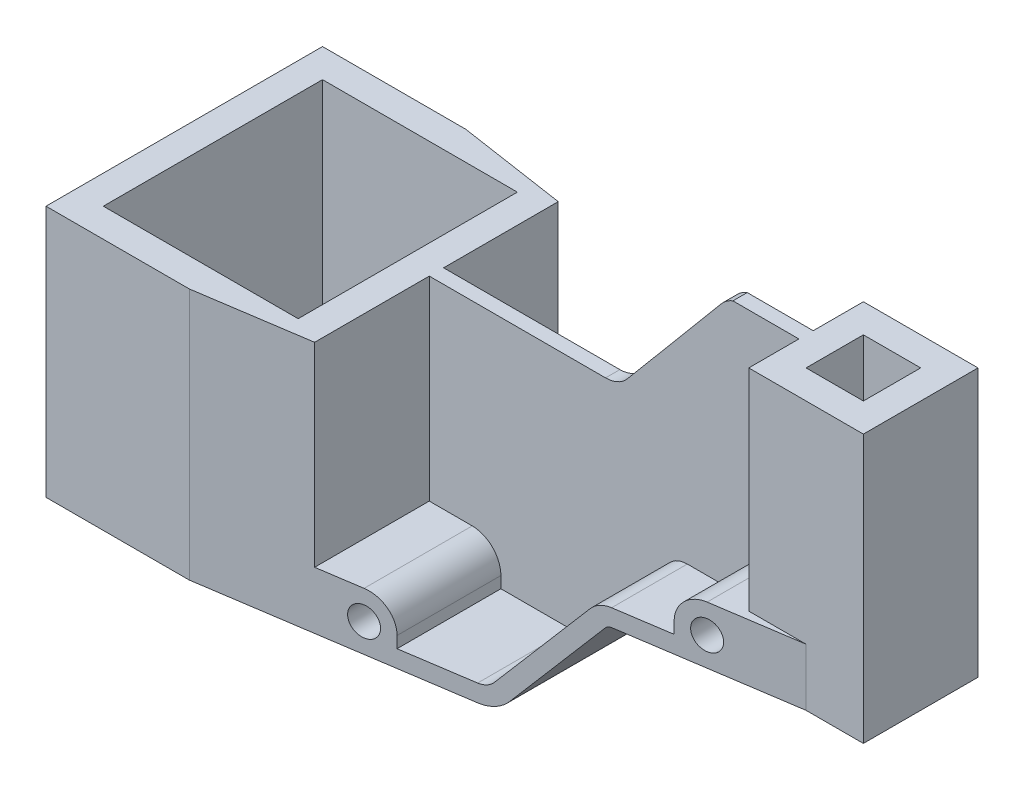
from build123d import *

# Parameters (mm, degrees)
BOSS_EXTRU_3_DEPTH       = 88
ESQUISSE4_W              = 68
ESQUISSE4_H              = 76.5
ENL_V_MAT_EXTRU_1_DEPTH  = 236.459258684
ENL_V_MAT_EXTRU_2_DEPTH  = 68
ENL_V_MAT_EXTRU_5_REACH  = 245.615
ESQUISSE6_W              = 150.690647389
ESQUISSE6_H              = 20
BOSS_EXTRU_5_DEPTH       = 20
ESQUISSE14_W             = 40
ESQUISSE14_H             = 40
ENL_V_MAT_EXTRU_6_DEPTH  = 236.459258684
BOSS_EXTRU_8_DEPTH       = 40
ENL_V_MAT_EXTRU_7_DEPTH  = 236.984242059
ESQUISSE27_W             = 169
ESQUISSE27_H             = 5
BOSS_EXTRU_9_DEPTH       = 45.5
BOSS_EXTRU_10_REACH      = 258.45
ESQUISSE28_R             = 5
ENL_V_MAT_EXTRU_9_DEPTH  = 45.5
BOSS_EXTRU_12_DEPTH      = 17.5
ENL_V_MAT_EXTRU_10_REACH = 248.129
BOSS_EXTRU_13_REACH      = 258.45
ESQUISSE34_R             = 5
BOSS_EXTRU_14_DEPTH      = 17.5
ESQUISSE36_W             = 20
ESQUISSE36_H             = 20
ENL_V_MAT_EXTRU_11_DEPTH = 256.967405152
ESQUISSE42_R             = 5
ENL_V_MAT_EXTRU_16_DEPTH = 10
ESQUISSE43_R             = 5
ENL_V_MAT_EXTRU_17_DEPTH = 10


with BuildPart() as part:
    # Esquisse1 → Boss.-Extru.3 (new body)
    with BuildSketch(Plane(origin=(0, 0, 0), x_dir=(1, 0, 0), z_dir=(0, 1, 0))):
        Polygon((193, 20), (6, 48.25), (-44, 48.25), (-44, -48.25), (6, -48.25), (193, -20), (213, -20), (213, 20), align=None)
    extrude(amount=BOSS_EXTRU_3_DEPTH)

    # Esquisse4 → Enlèv. mat.-Extru.1 (cut, through all)
    with BuildSketch(Plane(origin=(0, 88, 0), x_dir=(1, 0, 0), z_dir=(0, 1, 0))):
        Rectangle(ESQUISSE4_W, ESQUISSE4_H)
    extrude(amount=-ENL_V_MAT_EXTRU_1_DEPTH, mode=Mode.SUBTRACT)

    # Esquisse5 → Enlèv. mat.-Extru.2 (cut)
    with BuildSketch(Plane(origin=(0, 88, 0), x_dir=(1, 0, 0), z_dir=(0, 1, 0))):
        Polygon((193, 20), (173, 20), (173, 2.5), (44, 2.5), (44, 42.509358289), align=None)
        Polygon((173, -20), (193, -20), (44, -42.509358289), (44, -2.5), (173, -2.5), align=None)
    extrude(amount=-ENL_V_MAT_EXTRU_2_DEPTH, mode=Mode.SUBTRACT)

    # Enlèv. mat.-Extru.5: up to this plane
    enl_v_mat_extru_5_end = Plane(origin=(173, 20, 2.5), z_dir=(0, 0, -1))
    # Esquisse6 → Enlèv. mat.-Extru.5 (cut, up to the surface)
    with BuildSketch(Plane(origin=(7.260340781, 0, 48.059600925), x_dir=(0.9887806747234926, 0, -0.14937462064673088), z_dir=(0.14937462064673088, 0, 0.9887806747234927)), mode=Mode.PRIVATE) as enl_v_mat_extru_5_sk1:
        with Locations((112.501854115, 10)):
            Rectangle(ESQUISSE6_W, ESQUISSE6_H)
    enl_v_mat_extru_5_tool1 = split(extrude(enl_v_mat_extru_5_sk1.sketch, amount=-ENL_V_MAT_EXTRU_5_REACH, mode=Mode.PRIVATE), bisect_by=enl_v_mat_extru_5_end, keep=Keep.BOTH, mode=Mode.PRIVATE)
    add(enl_v_mat_extru_5_tool1.solids().sort_by_distance((118.5, 10, 31.254679))[0], mode=Mode.SUBTRACT)

    # Esquisse11 → Boss.-Extru.5 (add)
    with BuildSketch(Plane.XZ.offset(-20)):
        Polygon((37.955805499, 2.5), (44, 2.5), (44, 42.509358289), align=None)
    extrude(amount=BOSS_EXTRU_5_DEPTH)

    # Esquisse14 → Enlèv. mat.-Extru.6 (cut, through all)
    with BuildSketch(Plane(origin=(0, 88, 0), x_dir=(1, 0, 0), z_dir=(0, 1, 0))):
        with Locations((193, 0)):
            Rectangle(ESQUISSE14_W, ESQUISSE14_H)
    extrude(amount=-ENL_V_MAT_EXTRU_6_DEPTH, mode=Mode.SUBTRACT)

    # Esquisse22 → Boss.-Extru.8 (add)
    with BuildSketch(Plane(origin=(173, 0, 0), x_dir=(0, 0, -1), z_dir=(1, 0, 0))):
        Polygon((-2.5, 0), (20, 0), (20, 20), (2.5, 20), (2.5, 88), (-2.5, 88), align=None)
    extrude(amount=BOSS_EXTRU_8_DEPTH)

    # Esquisse23 → Enlèv. mat.-Extru.7 (cut, through all)
    with BuildSketch(Plane.XY.offset(2.5)):
        with BuildLine():
            Line((213, 0), (213, 40))
            Line((213, 40), (193, 40))
            Line((193, 40), (159, 40))
            Line((159, 40), (134.047464579, 40))
            ThreePointArc((134.047464579, 40), (133, 39.767782693), (132.14881397, 39.114644681))
            Line((132.14881397, 39.114644681), (103.122598553, 4.522548178))
            ThreePointArc((103.122598553, 4.522548178), (98.774593016, 1.186206186), (93.423962687, 0))
            Line((93.423962687, 0), (213, 0))
        make_face()
    extrude(amount=-ENL_V_MAT_EXTRU_7_DEPTH, mode=Mode.SUBTRACT)

    # Esquisse27 → Boss.-Extru.9 (add)
    with BuildSketch(Plane(origin=(0, 88, 0), x_dir=(1, 0, 0), z_dir=(0, 1, 0))):
        with Locations((128.5, 0)):
            Rectangle(ESQUISSE27_W, ESQUISSE27_H)
    extrude(amount=BOSS_EXTRU_9_DEPTH)

    # Boss.-Extru.10: up to this plane
    boss_extru_10_end = Plane(origin=(7.260340781, 88, 48.059600925), z_dir=(-0.14937462064673085, 0, -0.9887806747234926))
    # Esquisse28 → Boss.-Extru.10 (add, up to the surface)
    with BuildSketch(Plane.XY.offset(2.5), mode=Mode.PRIVATE) as boss_extru_10_sk1:
        with BuildLine():
            Line((103.122598553, 4.522548178), (132.14881397, 39.114644681))
            ThreePointArc((132.14881397, 39.114644681), (133, 39.767782693), (134.047464579, 40))
            Line((134.047464579, 40), (159, 40))
            Line((159, 40), (193, 40))
            Line((193, 40), (193, 60))
            Line((193, 60), (173, 60))
            Line((173, 60), (163, 60))
            ThreePointArc((163, 60), (155.928932188, 57.071067812), (153, 50))
            Line((153, 50), (153, 46))
            Line((153, 46), (134.047464579, 46))
            ThreePointArc((134.047464579, 46), (130.46429043, 45.205629416), (127.552547311, 42.971370339))
            Line((127.552547311, 42.971370339), (98.526331894, 8.379273836))
            ThreePointArc((98.526331894, 8.379273836), (96.238883445, 6.624052908), (93.423962687, 6))
            Line((93.423962687, 6), (69, 6))
            Line((69, 6), (69, 10))
            ThreePointArc((69, 10), (66.071067812, 17.071067812), (59, 20))
            Line((59, 20), (44, 20))
            Line((44, 20), (44, 0))
            Line((44, 0), (63, 0))
            Line((63, 0), (93.423962687, 0))
            ThreePointArc((93.423962687, 0), (98.774593016, 1.186206186), (103.122598553, 4.522548178))
        make_face()
        with Locations((59, 10)):
            Circle(ESQUISSE28_R, mode=Mode.SUBTRACT)
        with Locations((163, 50)):
            Circle(ESQUISSE28_R, mode=Mode.SUBTRACT)
    boss_extru_10_tool1 = split(extrude(boss_extru_10_sk1.sketch, amount=BOSS_EXTRU_10_REACH, mode=Mode.PRIVATE), bisect_by=boss_extru_10_end, keep=Keep.BOTH, mode=Mode.PRIVATE)
    add(boss_extru_10_tool1.solids().sort_by_distance((124.30992, 30.316725, 2.5))[0])

    # Esquisse29 → Enlèv. mat.-Extru.9 (cut)
    with BuildSketch(Plane.XY.offset(2.5)):
        with BuildLine():
            ThreePointArc((145.939599002, 130.613536933), (147.768845256, 132.309522469), (149.96093833, 133.5))
            Line((149.96093833, 133.5), (44, 133.5))
            Line((44, 133.5), (44, 88))
            Line((44, 88), (105.519519296, 88))
            ThreePointArc((105.519519296, 88), (109.745701914, 88.93692213), (113.179963727, 91.572123903))
            Line((113.179963727, 91.572123903), (145.939599002, 130.613536933))
        make_face()
    extrude(amount=-ENL_V_MAT_EXTRU_9_DEPTH, mode=Mode.SUBTRACT)

    # Esquisse31 → Boss.-Extru.12 (add)
    with BuildSketch(Plane.XY.offset(2.5)):
        Polygon((213, 133.5), (173, 133.5), (173, 60), (193, 60), (193, 40), (213, 40), align=None)
    extrude(amount=BOSS_EXTRU_12_DEPTH)

    # Esquisse33 → Enlèv. mat.-Extru.10 (cut, up to next)
    with BuildSketch(Plane(origin=(0, 20, 0), x_dir=(1, 0, 0), z_dir=(0, 1, 0)), mode=Mode.PRIVATE) as enl_v_mat_extru_10_sk1:
        Polygon((44, 42.509358289), (44, 2.5), (116.109722668, 2.5), (116.109722668, 31.615777191), align=None)
    enl_v_mat_extru_10_tool1 = extrude(enl_v_mat_extru_10_sk1.sketch, amount=-ENL_V_MAT_EXTRU_10_REACH, mode=Mode.PRIVATE) & part.part
    add(enl_v_mat_extru_10_tool1.solids().sort_by_distance((78.160873, 20, -19.924346))[0], mode=Mode.SUBTRACT)

    # Boss.-Extru.13: up to this plane
    boss_extru_13_end = Plane(origin=(7.260340781, 88, -48.059600925), z_dir=(0.14937462064673085, 0, -0.9887806747234926))
    # Esquisse34 → Boss.-Extru.13 (add, up to the surface)
    with BuildSketch(Plane(origin=(0, 0, -2.5), x_dir=(-1, 0, 0), z_dir=(0, 0, -1)), mode=Mode.PRIVATE) as boss_extru_13_sk1:
        with BuildLine():
            Line((-44, 0), (-44, 20))
            Line((-44, 20), (-59, 20))
            ThreePointArc((-59, 20), (-66.071067812, 17.071067812), (-69, 10))
            Line((-69, 10), (-69, 6))
            Line((-69, 6), (-93.423962687, 6))
            ThreePointArc((-93.423962687, 6), (-96.238883445, 6.624052908), (-98.526331894, 8.379273836))
            Line((-98.526331894, 8.379273836), (-127.552547311, 42.971370339))
            ThreePointArc((-127.552547311, 42.971370339), (-130.46429043, 45.205629416), (-134.047464579, 46))
            Line((-134.047464579, 46), (-153, 46))
            Line((-153, 46), (-153, 50))
            ThreePointArc((-153, 50), (-155.928932188, 57.071067812), (-163, 60))
            Line((-163, 60), (-173, 60))
            Line((-173, 60), (-193, 60))
            Line((-193, 60), (-193, 40))
            Line((-193, 40), (-159, 40))
            Line((-159, 40), (-134.047464579, 40))
            ThreePointArc((-134.047464579, 40), (-133, 39.767782693), (-132.14881397, 39.114644681))
            Line((-132.14881397, 39.114644681), (-103.122598553, 4.522548178))
            ThreePointArc((-103.122598553, 4.522548178), (-98.774593016, 1.186206186), (-93.423962687, 0))
            Line((-93.423962687, 0), (-63, 0))
            Line((-63, 0), (-44, 0))
        make_face()
        with Locations(Location((-163, 50, 0), (0, 0, 180))):
            Circle(ESQUISSE34_R, mode=Mode.SUBTRACT)
        with Locations(Location((-59, 10, 0), (0, 0, 180))):
            Circle(ESQUISSE34_R, mode=Mode.SUBTRACT)
    boss_extru_13_tool1 = split(extrude(boss_extru_13_sk1.sketch, amount=BOSS_EXTRU_13_REACH, mode=Mode.PRIVATE), bisect_by=boss_extru_13_end, keep=Keep.BOTH, mode=Mode.PRIVATE)
    add(boss_extru_13_tool1.solids().sort_by_distance((124.30992, 30.316725, -2.5))[0])

    # Esquisse35 → Boss.-Extru.14 (add)
    with BuildSketch(Plane(origin=(0, 0, -2.5), x_dir=(-1, 0, 0), z_dir=(0, 0, -1))):
        Polygon((-173, 60), (-173, 133.5), (-213, 133.5), (-213, 40), (-193, 40), (-193, 60), align=None)
    extrude(amount=BOSS_EXTRU_14_DEPTH)

    # Esquisse36 → Enlèv. mat.-Extru.11 (cut, through all)
    with BuildSketch(Plane(origin=(0, 133.5, 0), x_dir=(1, 0, 0), z_dir=(0, 1, 0))):
        with Locations((193, 0)):
            Rectangle(ESQUISSE36_W, ESQUISSE36_H)
    extrude(amount=-ENL_V_MAT_EXTRU_11_DEPTH, mode=Mode.SUBTRACT)

    # Esquisse42 → Enlèv. mat.-Extru.16 (cut)
    with BuildSketch(Plane(origin=(0, 0, -2.5), x_dir=(-1, 0, 0), z_dir=(0, 0, -1))):
        with Locations(Location((-59, 10, 0), (0, 0, 180))):
            Circle(ESQUISSE42_R)
    extrude(amount=-ENL_V_MAT_EXTRU_16_DEPTH, mode=Mode.SUBTRACT)

    # Esquisse43 → Enlèv. mat.-Extru.17 (cut)
    with BuildSketch(Plane(origin=(0, 0, -2.5), x_dir=(-1, 0, 0), z_dir=(0, 0, -1))):
        with Locations(Location((-163, 50, 0), (0, 0, 180))):
            Circle(ESQUISSE43_R)
    extrude(amount=-ENL_V_MAT_EXTRU_17_DEPTH, mode=Mode.SUBTRACT)


solid = part.part
